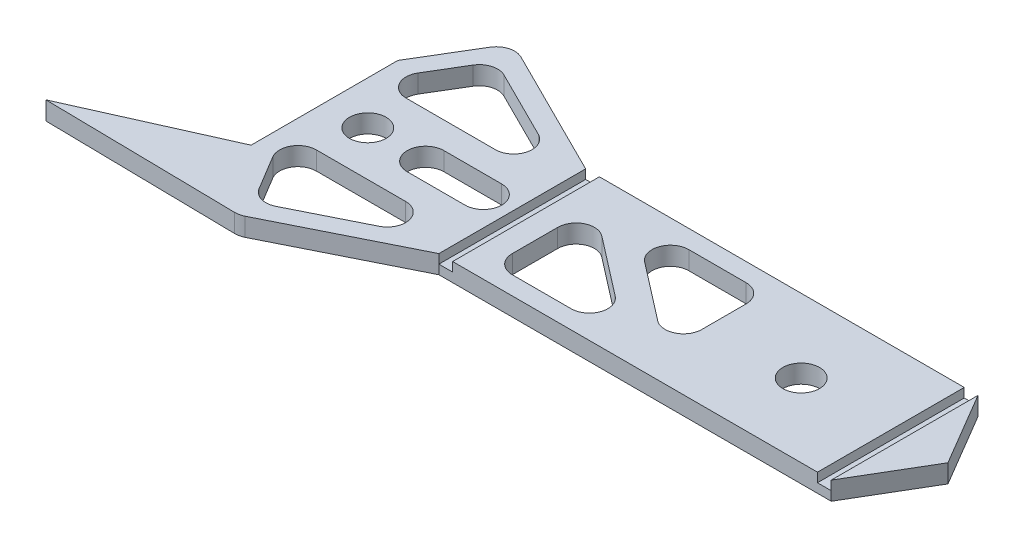
from build123d import *

# Parameters (mm, degrees)
CROQUIS1_R              = 6.35
SALIENTE_EXTRUIR1_DEPTH = 6.35
CROQUIS4_W              = 4.7625
CROQUIS4_H              = 50.8
CORTAR_EXTRUIR1_DEPTH   = 3.175


with BuildPart() as part:
    # Croquis1 → Saliente-Extruir1 (new body)
    with BuildSketch(Plane(origin=(0, 0, 0), x_dir=(1, 0, 0), z_dir=(0, 1, 0))):
        with BuildLine():
            Line((35.8, -25.4), (50.8, 0))
            Line((50.8, 0), (35.8, 25.4))
            Line((35.8, 25.4), (-100, 25.4))
            Line((-100, 25.4), (-144.746813481, 47.731727951))
            ThreePointArc((-144.746813481, 47.731727951), (-149.357530471, 48.146831931), (-153.024774803, 45.321528145))
            Line((-153.024774803, 45.321528145), (-165, 25.4))
            Line((-165, 25.4), (-165, -25.4))
            Line((-165, -25.4), (-214.07384035, -47.316891892))
            Line((-214.07384035, -47.316891892), (-147.685890016, -48.399156383))
            ThreePointArc((-147.685890016, -48.399156383), (-146.176180179, -48.24234101), (-144.746813481, -47.731727951))
            Line((-144.746813481, -47.731727951), (-100, -25.4))
            Line((-100, -25.4), (35.8, -25.4))
        make_face()
        with Locations(Location((0, 0, 0), (0, 0, 270))):
            Circle(CROQUIS1_R, mode=Mode.SUBTRACT)
        with Locations(Location((-150, 0, 0), (0, 0, 270))):
            Circle(CROQUIS1_R, mode=Mode.SUBTRACT)
        with BuildLine():
            Line((-118.545100716, 27.558404082), (-142.329198773, 39.428299747))
            ThreePointArc((-142.329198773, 39.428299747), (-146.939915763, 39.843403727), (-150.607160095, 37.018099941))
            Line((-150.607160095, 37.018099941), (-157.742389512, 25.148204276))
            ThreePointArc((-157.742389512, 25.148204276), (-157.827056347, 18.750312726), (-152.3, 15.526676131))
            Line((-152.3, 15.526676131), (-121.380672526, 15.526676131))
            ThreePointArc((-121.380672526, 15.526676131), (-115.199998109, 20.420048603), (-118.545100716, 27.558404082))
        make_face(mode=Mode.SUBTRACT)
        with BuildLine():
            Line((-118.545100716, -27.558404082), (-142.329198773, -39.428299747))
            ThreePointArc((-142.329198773, -39.428299747), (-146.939915763, -39.843403727), (-150.607160095, -37.018099941))
            Line((-150.607160095, -37.018099941), (-157.742389512, -25.148204276))
            ThreePointArc((-157.742389512, -25.148204276), (-157.827056347, -18.750312726), (-152.3, -15.526676131))
            Line((-152.3, -15.526676131), (-121.380672526, -15.526676131))
            ThreePointArc((-121.380672526, -15.526676131), (-115.199998109, -20.420048603), (-118.545100716, -27.558404082))
        make_face(mode=Mode.SUBTRACT)
        with BuildLine():
            Line((-130, 6.35), (-110, 6.35))
            ThreePointArc((-110, 6.35), (-103.65, 0), (-110, -6.35))
            Line((-110, -6.35), (-130, -6.35))
            ThreePointArc((-130, -6.35), (-136.35, 0), (-130, 6.35))
        make_face(mode=Mode.SUBTRACT)
        with BuildLine():
            Line((-56.70082756, -7.67562673), (-77.066937646, 8.064222026))
            ThreePointArc((-77.066937646, 8.064222026), (-83.748665223, 8.739846385), (-87.3, 3.039848756))
            Line((-87.3, 3.039848756), (-87.3, -12.7))
            ThreePointArc((-87.3, -12.7), (-85.440128061, -17.190128061), (-80.95, -19.05))
            Line((-80.95, -19.05), (-60.583889913, -19.05))
            ThreePointArc((-60.583889913, -19.05), (-54.57442778, -14.751551819), (-56.70082756, -7.67562673))
        make_face(mode=Mode.SUBTRACT)
        with BuildLine():
            Line((-57.963298738, 19.05), (-38.1, 19.05))
            ThreePointArc((-38.1, 19.05), (-33.609871939, 17.190128061), (-31.75, 12.7))
            Line((-31.75, 12.7), (-31.75, -2.651253459))
            ThreePointArc((-31.75, -2.651253459), (-35.301334777, -8.351251089), (-41.983062354, -7.67562673))
            Line((-41.983062354, -7.67562673), (-61.846361092, 7.67562673))
            ThreePointArc((-61.846361092, 7.67562673), (-63.972760872, 14.751551819), (-57.963298738, 19.05))
        make_face(mode=Mode.SUBTRACT)
    extrude(amount=SALIENTE_EXTRUIR1_DEPTH)

    # Croquis4 → Cortar-Extruir1 (cut)
    with BuildSketch(Plane(origin=(0, 6.35, 0), x_dir=(1, 0, 0), z_dir=(0, 1, 0))):
        with Locations((-97.61875, 0)):
            Rectangle(CROQUIS4_W, CROQUIS4_H)
        with Locations((33.41875, 0)):
            Rectangle(CROQUIS4_W, CROQUIS4_H)
    extrude(amount=-CORTAR_EXTRUIR1_DEPTH, mode=Mode.SUBTRACT)


solid = part.part
